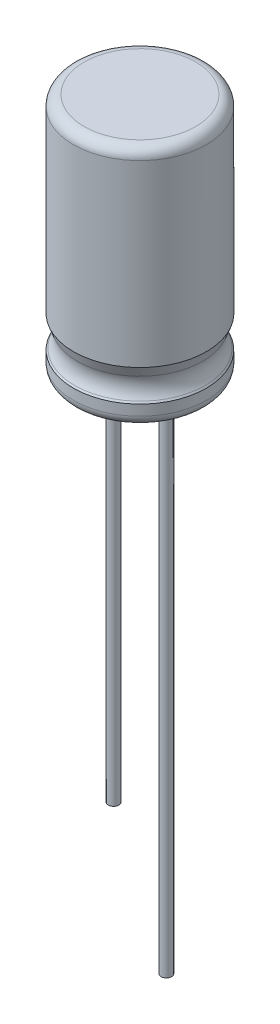
from build123d import *

# Parameters (mm, degrees)
REDONDEO1_R                = 1
REDONDEO2_R                = 0.5
REDONDEO3_R                = 0.5
SALIENTE_EXTRUIR1_DEPTH    = 0.2
SALIENTE_EXTRUIR1_2_DEPTH  = 0.2
CROQUIS6_R                 = 0.25
SALIENTE_EXTRUIR16_DEPTH   = 24
SALIENTE_EXTRUIR16_2_DEPTH = 24
CORTAR_EXTRUIR2_DEPTH      = 5
CORTAR_EXTRUIR2_DEPTH_BACK = 5
CROQUIS7_W                 = 0.5
CROQUIS7_H                 = 5.8


with BuildPart() as part:
    # Croquis1 → Revolución1 (revolve)
    with BuildSketch(Plane.XY, mode=Mode.PRIVATE) as revoluci_n1_sk:
        Polygon((0, 0), (3.15, 0), (3.15, 1), (2.781834713, 1.513847513), (3.15, 2.5), (3.15, 11.5), (0, 11.5), align=None)
    revolve(revoluci_n1_sk.sketch.rotate(Axis((0, 11.5, 0), (0, -1, 0)), 90), axis=Axis((0, 11.5, 0), (0, -1, 0)))

    # Redondeo1
    redondeo1_edges = [part.edges().sort_by_distance(p)[0] for p in [
        (0, 1.513847513, -2.781834713),
    ]]
    fillet(redondeo1_edges, radius=REDONDEO1_R)

    # Redondeo2
    redondeo2_edges = [part.edges().sort_by_distance(p)[0] for p in [
        (0, 11.5, -3.15),
    ]]
    fillet(redondeo2_edges, radius=REDONDEO2_R)

    # Redondeo3
    redondeo3_edges = [part.edges().sort_by_distance(p)[0] for p in [
        (0, 0, -3.15),
    ]]
    fillet(redondeo3_edges, radius=REDONDEO3_R)


with BuildPart() as body_2:
    # Croquis2 → Saliente-Extruir1 (new body)
    with BuildSketch(Plane.XZ):
        with BuildLine():
            ThreePointArc((-1.75, 0), (-1.408113883, 0.474341649), (-0.85, 0.3))
            Line((-0.85, 0.3), (0.85, 0.3))
            ThreePointArc((0.85, 0.3), (1.408113883, 0.474341649), (1.75, 0))
            ThreePointArc((1.75, 0), (0, 1.75), (-1.75, 0))
        make_face()
    extrude(amount=SALIENTE_EXTRUIR1_DEPTH)


with BuildPart() as body_3:
    # Croquis2 → Saliente-Extruir1 2 (new body)
    with BuildSketch(Plane.XZ):
        with BuildLine():
            ThreePointArc((-0.85, -0.3), (-1.408113883, -0.474341649), (-1.75, 0))
            ThreePointArc((-1.75, 0), (0, -1.75), (1.75, 0))
            ThreePointArc((1.75, 0), (1.408113883, -0.474341649), (0.85, -0.3))
            Line((0.85, -0.3), (-0.85, -0.3))
        make_face()
    extrude(amount=SALIENTE_EXTRUIR1_2_DEPTH)


with BuildPart() as body_4:
    # Croquis6 → Saliente-Extruir16 (new body)
    with BuildSketch(Plane(origin=(0, -24, 0), x_dir=(1, 0, 0), z_dir=(0, 1, 0))):
        with Locations(Location((1.25, 0, 0), (0, 0, 270))):
            Circle(CROQUIS6_R)
    extrude(amount=SALIENTE_EXTRUIR16_DEPTH)


with BuildPart() as body_5:
    # Croquis6 → Saliente-Extruir16 2 (new body)
    with BuildSketch(Plane(origin=(0, -24, 0), x_dir=(1, 0, 0), z_dir=(0, 1, 0))):
        with Locations(Location((-1.25, 0, 0), (0, 0, 270))):
            Circle(CROQUIS6_R)
    extrude(amount=SALIENTE_EXTRUIR16_2_DEPTH)

    # Croquis7 → Cortar-Extruir2 (cut, two sides: drawn at the far end of the back side and taken through both)
    with BuildSketch(Plane.XY.offset(-CORTAR_EXTRUIR2_DEPTH_BACK)):
        with Locations((-1.25, -21.1)):
            Rectangle(CROQUIS7_W, CROQUIS7_H)
    extrude(amount=CORTAR_EXTRUIR2_DEPTH + CORTAR_EXTRUIR2_DEPTH_BACK, mode=Mode.SUBTRACT)


solid = Compound([part.part, body_2.part, body_3.part, body_4.part, body_5.part])
